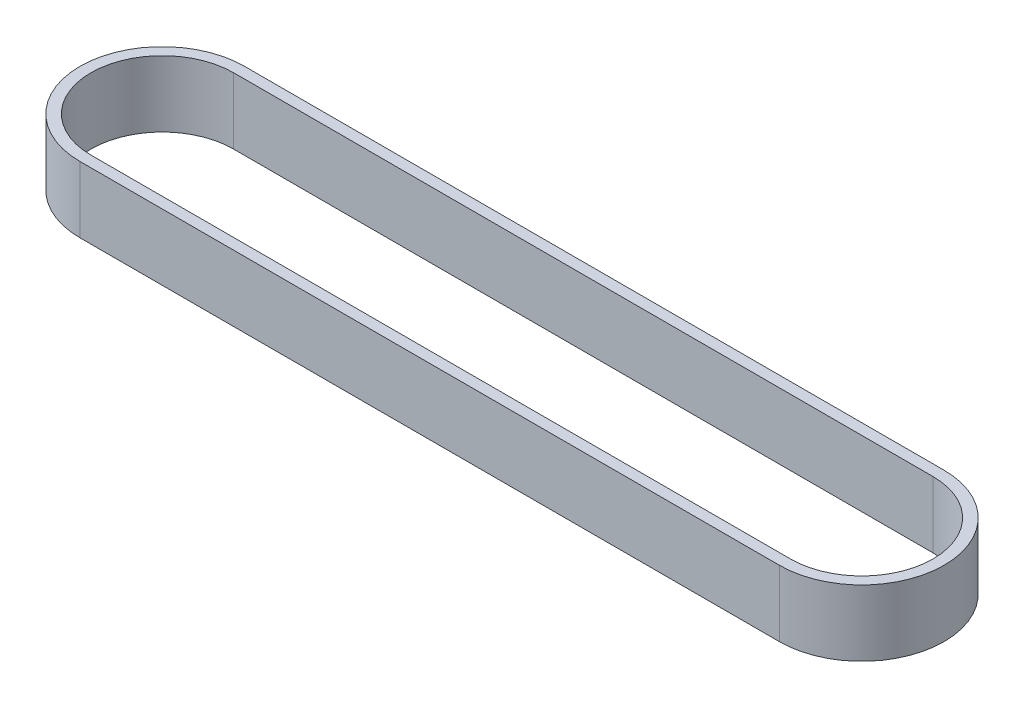
from build123d import *

# Parameters (mm, degrees)
EXTRUDE_1_DEPTH = 6


with BuildPart() as part:
    # 草图1 → 凸台-拉伸1 (new body)
    with BuildSketch(Plane(origin=(0, 0, 0), x_dir=(1, 0, 0), z_dir=(0, 1, 0))):
        with BuildLine():
            Line((-31.73, 7.47), (31.73, 7.47))
            ThreePointArc((31.73, 7.47), (39.2, 0), (31.73, -7.47))
            Line((31.73, -7.47), (-31.73, -7.47))
            ThreePointArc((-31.73, -7.47), (-39.2, 0), (-31.73, 7.47))
        make_face()
        with BuildLine():
            Line((-31.73, 6.47), (31.73, 6.47))
            ThreePointArc((31.73, 6.47), (38.2, 0), (31.73, -6.47))
            Line((31.73, -6.47), (-31.73, -6.47))
            ThreePointArc((-31.73, -6.47), (-38.2, 0), (-31.73, 6.47))
        make_face(mode=Mode.SUBTRACT)
    extrude(amount=EXTRUDE_1_DEPTH)


solid = part.part
